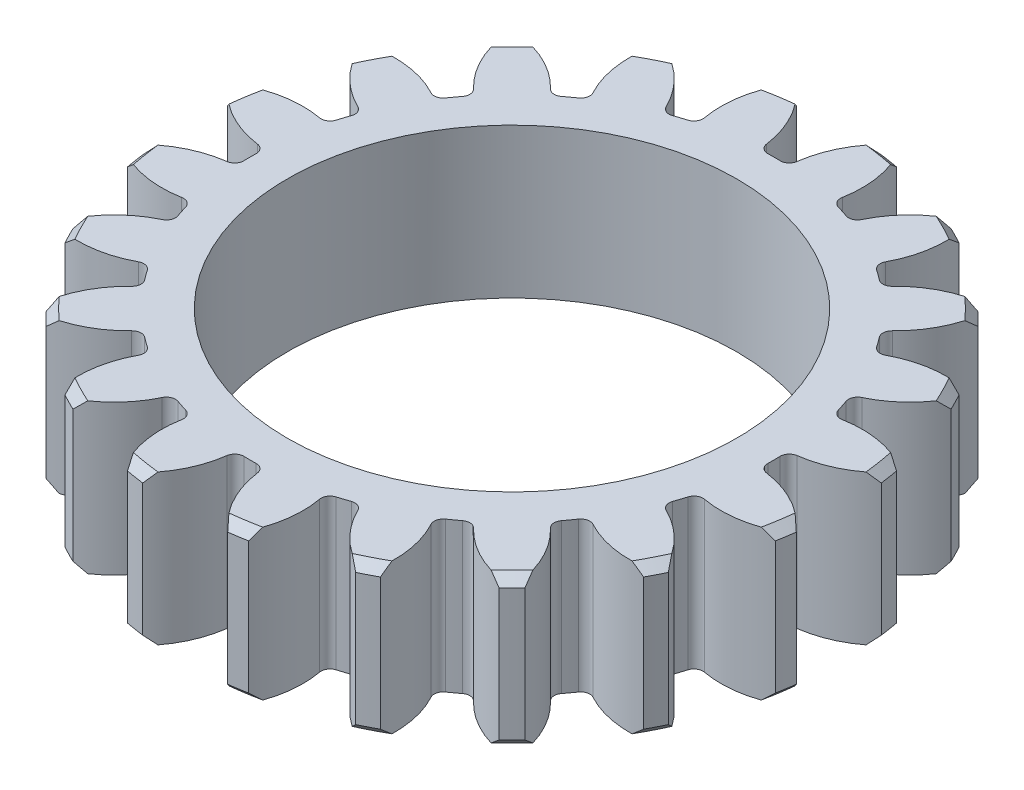
from build123d import *

# Parameters (mm, degrees)
SKETCH1_R                = 22
BOSS_EXTRUDE1_DEPTH      = 10
CUT_EXTRUDE1_DEPTH       = 10
FILLET1_R                = 0.6
CHAMFER1_SIZE            = 0.6
CIRPATTERN1_COUNT        = 20
FILLET1_OF_CIRPATTERN1_R = 0.6
SKETCH3_R                = 15
CUT_EXTRUDE2_DEPTH       = 10


with BuildPart() as part:
    # Sketch1 → Boss-Extrude1 (new body)
    with BuildSketch(Plane(origin=(0, 0, 0), x_dir=(1, 0, 0), z_dir=(0, 1, 0))):
        with Locations(Location((0, 0, 0), (0, 0, 270))):
            Circle(SKETCH1_R)
    extrude(amount=BOSS_EXTRUDE1_DEPTH)

    # Sketch2 → Cut-Extrude1 (cut)
    with BuildSketch(Plane.XZ):
        with BuildLine():
            ThreePointArc((-2.83665719, 21.816355699), (-1.513028297, 19.811754334), (-0.962550115, 17.473508442))
            ThreePointArc((-0.962550115, 17.473508442), (0, 17.5), (0.962550115, 17.473508442))
            ThreePointArc((0.962550115, 17.473508442), (1.513028297, 19.811754334), (2.83665719, 21.816355699))
            ThreePointArc((2.83665719, 21.816355699), (0, 22), (-2.83665719, 21.816355699))
        make_face()
    cut_extrude1 = extrude(amount=-CUT_EXTRUDE1_DEPTH, mode=Mode.SUBTRACT)

    # Fillet1
    fillet1_edges = [part.edges().sort_by_distance(p)[0] for p in [
        (-0.962550115, 5, 17.473508442),
        (0.962550115, 5, 17.473508442),
    ]]
    fillet(fillet1_edges, radius=FILLET1_R)

    # Chamfer1
    chamfer1_edges = [part.edges().sort_by_distance(p)[0] for p in [
        (0, 0, -22),
        (0, 10, -22),
    ]]
    chamfer(chamfer1_edges, length=CHAMFER1_SIZE)

    # CirPattern1: Cut-Extrude1 ×20 about axis
    cirpattern1_axis = Axis((0, 0, 0), (0, 1, 0))
    for i in range(1, CIRPATTERN1_COUNT):
        add(cut_extrude1.rotate(cirpattern1_axis, i * 360 / CIRPATTERN1_COUNT), mode=Mode.SUBTRACT)

    # Fillet1 of CirPattern1
    fillet1_of_cirpattern1_edges = [part.edges().sort_by_distance(p)[0] for p in [
        (4.4841715, 5, 16.91573841),
        (6.31505062, 5, 16.320849723),
        (9.491951167, 5, 14.702138043),
        (11.049389969, 5, 13.570592519),
        (13.570592519, 5, 11.049389969),
        (14.702138043, 5, 9.491951167),
        (16.320849723, 5, 6.31505062),
        (16.91573841, 5, 4.4841715),
        (17.473508442, 5, 0.962550115),
        (17.473508442, 5, -0.962550115),
        (16.91573841, 5, -4.4841715),
        (16.320849723, 5, -6.31505062),
        (14.702138043, 5, -9.491951167),
        (13.570592519, 5, -11.049389969),
        (11.049389969, 5, -13.570592519),
        (9.491951167, 5, -14.702138043),
        (6.31505062, 5, -16.320849723),
        (4.4841715, 5, -16.91573841),
        (0.962550115, 5, -17.473508442),
        (-0.962550115, 5, -17.473508442),
        (-4.4841715, 5, -16.91573841),
        (-6.31505062, 5, -16.320849723),
        (-9.491951167, 5, -14.702138043),
        (-11.049389969, 5, -13.570592519),
        (-13.570592519, 5, -11.049389969),
        (-14.702138043, 5, -9.491951167),
        (-16.320849723, 5, -6.31505062),
        (-16.91573841, 5, -4.4841715),
        (-17.473508442, 5, -0.962550115),
        (-17.473508442, 5, 0.962550115),
        (-16.91573841, 5, 4.4841715),
        (-16.320849723, 5, 6.31505062),
        (-14.702138043, 5, 9.491951167),
        (-13.570592519, 5, 11.049389969),
        (-11.049389969, 5, 13.570592519),
        (-9.491951167, 5, 14.702138043),
        (-6.31505062, 5, 16.320849723),
        (-4.4841715, 5, 16.91573841),
    ]]
    fillet(fillet1_of_cirpattern1_edges, radius=FILLET1_OF_CIRPATTERN1_R)

    # Sketch3 → Cut-Extrude2 (cut)
    with BuildSketch(Plane.XZ):
        with Locations(Location((0, 0, 0), (0, 0, 270))):
            Circle(SKETCH3_R)
    extrude(amount=-CUT_EXTRUDE2_DEPTH, mode=Mode.SUBTRACT)


solid = part.part
